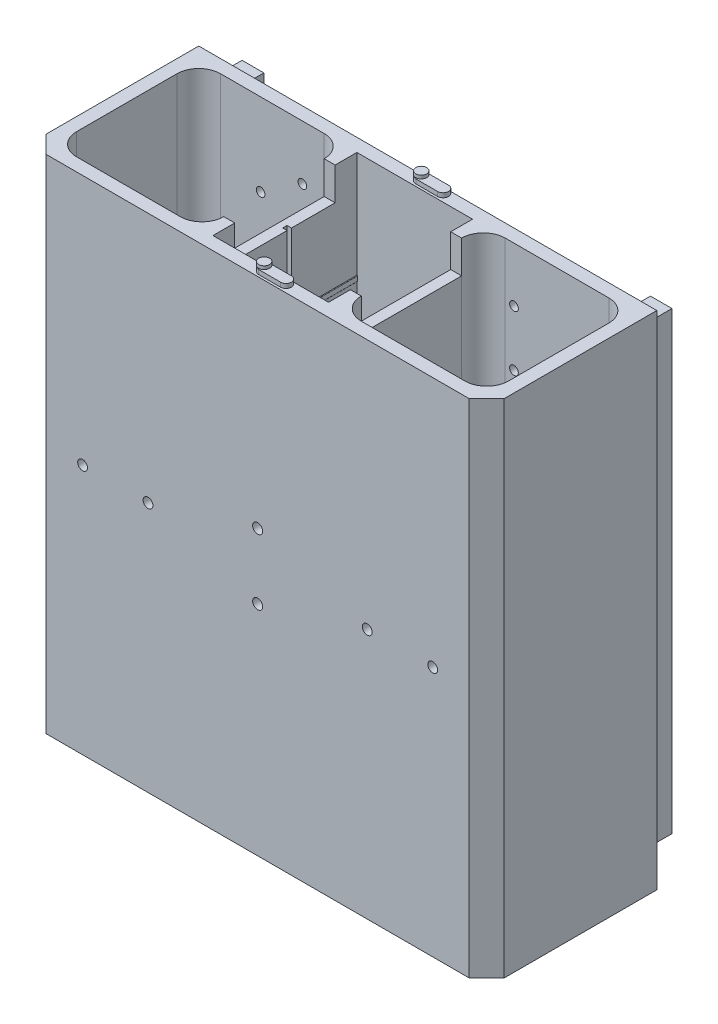
from build123d import *

# Parameters (mm, degrees)
SKETCH_1_W           = 210
SKETCH_1_H           = 230
EXTRUDE_1_DEPTH      = 6
SKETCH_2_W           = 9.85
SKETCH_2_H           = 208.5
SKETCH_2_W_2         = 10
EXTRUDE_3_DEPTH      = 15
SKETCH_3_R           = 2
CUT_EXTRUDE_1_DEPTH  = 10
SKETCH_17_W          = 6
SKETCH_17_H          = 230
EXTRUDE_9_DEPTH      = 66
EXTRUDE_10_DEPTH     = 6
CHAMFER_3_SIZE       = 8
SKETCH_19_W          = 5
SKETCH_19_H          = 230
EXTRUDE_11_DEPTH     = 66
FILLET_4_R           = 10
SKETCH_21_R          = 2.3
CUT_EXTRUDE_9_DEPTH  = 6
EXTRUDE_13_DEPTH     = 66
SKETCH_28_W          = 53
SKETCH_28_H          = 3
EXTRUDE_14_DEPTH     = 66
SKETCH_30_W          = 2
SKETCH_30_H          = 2
CUT_EXTRUDE_10_DEPTH = 35
SKETCH_31_R          = 1.35
SKETCH_31_W          = 14
SKETCH_31_H          = 14
CUT_EXTRUDE_11_DEPTH = 316.06185361
SKETCH_34_R          = 2.25
CUT_EXTRUDE_14_DEPTH = 30
SKETCH_36_R          = 2.25
CUT_EXTRUDE_15_DEPTH = 30
SKETCH_39_W          = 46
SKETCH_39_H          = 15
CUT_EXTRUDE_16_DEPTH = 104
SKETCH_40_R          = 1.5
EXTRUDE_16_DEPTH     = 3
SKETCH_41_R          = 2.5
EXTRUDE_17_DEPTH     = 1.5
SKETCH_44_R          = 1.62
EXTRUDE_19_DEPTH     = 2
SKETCH_46_R          = 1.62
EXTRUDE_20_DEPTH     = 2
SKETCH_49_W          = 12
SKETCH_49_H          = 8.46
CUT_EXTRUDE_17_DEPTH = 10
SKETCH_50_W          = 20
SKETCH_50_H          = 8.46
CUT_EXTRUDE_18_DEPTH = 10


with BuildPart() as part:
    # 草图1 → 凸台-拉伸1 (new body)
    with BuildSketch(Plane.XY):
        with Locations((105, 115)):
            Rectangle(SKETCH_1_W, SKETCH_1_H)
    extrude(amount=EXTRUDE_1_DEPTH)

    # 草图2 → 凸台-拉伸3 (add)
    with BuildSketch(Plane(origin=(0, 0, 0), x_dir=(-1, 0, 0), z_dir=(0, 0, -1))):
        with Locations((-197, 115)):
            Rectangle(SKETCH_2_W, SKETCH_2_H)
        with Locations((-9.85, 115)):
            Rectangle(SKETCH_2_W_2, SKETCH_2_H)
    extrude(amount=EXTRUDE_3_DEPTH)

    # 草图3 → 切除-拉伸1 (cut)
    with BuildSketch(Plane(origin=(0, 0, 0), x_dir=(-1, 0, 0), z_dir=(0, 0, -1))):
        with Locations((-169.6425573, 192.25)):
            Circle(SKETCH_3_R)
        with Locations((-150.5, 205)):
            Circle(SKETCH_3_R)
        with Locations((-150.5, 179.5)):
            Circle(SKETCH_3_R)
        with Locations(Location((-150.5, 50.5, 0), (0, 0, 180))):
            Circle(SKETCH_3_R)
        with Locations(Location((-150.5, 25, 0), (0, 0, 180))):
            Circle(SKETCH_3_R)
        with Locations(Location((-169.6425573, 37.75, 0), (0, 0, 180))):
            Circle(SKETCH_3_R)
        with Locations((-34.3574427, 192.25)):
            Circle(SKETCH_3_R)
        with Locations((-53.5, 205)):
            Circle(SKETCH_3_R)
        with Locations((-53.5, 179.5)):
            Circle(SKETCH_3_R)
        with Locations(Location((-53.5, 50.5, 0), (0, 0, 180))):
            Circle(SKETCH_3_R)
        with Locations(Location((-53.5, 25, 0), (0, 0, 180))):
            Circle(SKETCH_3_R)
        with Locations(Location((-34.3574427, 37.75, 0), (0, 0, 180))):
            Circle(SKETCH_3_R)
    extrude(amount=-CUT_EXTRUDE_1_DEPTH, mode=Mode.SUBTRACT)

    # 草图17 → 凸台-拉伸9 (add)
    with BuildSketch(Plane.XY.offset(6)):
        with Locations((3, 115)):
            Rectangle(SKETCH_17_W, SKETCH_17_H)
        with Locations((207, 115)):
            Rectangle(SKETCH_17_W, SKETCH_17_H)
    extrude(amount=EXTRUDE_9_DEPTH)

    # 草图18 → 凸台-拉伸10 (add)
    with BuildSketch(Plane.XY.offset(72)):
        Polygon((210, 230), (204, 230), (6, 230), (0, 230), (0, 0), (6, 0), (204, 0), (210, 0), align=None)
    extrude(amount=EXTRUDE_10_DEPTH)

    # 倒角3
    chamfer_3_edges = [part.edges().sort_by_distance(p)[0] for p in [
        (210, 115, 78),
        (0, 115, 78),
    ]]
    chamfer(chamfer_3_edges, length=CHAMFER_3_SIZE)

    # 草图19 → 凸台-拉伸11 (add)
    with BuildSketch(Plane(origin=(0, 0, 72), x_dir=(-1, 0, 0), z_dir=(0, 0, -1))):
        with Locations((-134, 115)):
            Rectangle(SKETCH_19_W, SKETCH_19_H)
        with Locations((-76, 115)):
            Rectangle(SKETCH_19_W, SKETCH_19_H)
    extrude(amount=EXTRUDE_11_DEPTH)

    # 圆角4
    fillet_4_edges = [part.edges().sort_by_distance(p)[0] for p in [
        (6, 115, 6),
        (6, 115, 72),
        (204, 115, 6),
        (204, 115, 72),
        (73.5, 115, 6),
        (73.5, 115, 72),
        (136.5, 115, 72),
        (136.5, 115, 6),
    ]]
    fillet(fillet_4_edges, radius=FILLET_4_R)

    # 草图21 → 切除-拉伸9 (cut)
    with BuildSketch(Plane.XY.offset(72)):
        with Locations((105, 130)):
            Circle(SKETCH_21_R)
        with Locations((105, 100)):
            Circle(SKETCH_21_R)
    extrude(amount=CUT_EXTRUDE_9_DEPTH, mode=Mode.SUBTRACT)

    # 草图26 → 凸台-拉伸13 (add)
    with BuildSketch(Plane(origin=(0, 0, 72), x_dir=(-1, 0, 0), z_dir=(0, 0, -1))):
        with BuildLine():
            Line((-131.26, 181), (-131.26, 179))
            ThreePointArc((-131.26, 179), (-131.5, 178.76), (-131.74, 179))
            Line((-131.74, 179), (-131.74, 181))
            ThreePointArc((-131.74, 181), (-131.5, 181.24), (-131.26, 181))
        make_face()
        with BuildLine():
            Line((-131.26, 22.5), (-131.26, 20.5))
            ThreePointArc((-131.26, 20.5), (-131.5, 20.26), (-131.74, 20.5))
            Line((-131.74, 20.5), (-131.74, 22.5))
            ThreePointArc((-131.74, 22.5), (-131.5, 22.74), (-131.26, 22.5))
        make_face()
    extrude_13 = extrude(amount=EXTRUDE_13_DEPTH)

    # 镜向2: 凸台-拉伸13 across plane
    add(extrude_13.mirror(Plane.ZY.offset(-105)))

    # 草图28 → 凸台-拉伸14 (add)
    with BuildSketch(Plane(origin=(0, 0, 72), x_dir=(-1, 0, 0), z_dir=(0, 0, -1))):
        with Locations((-105, 9.96)):
            Rectangle(SKETCH_28_W, SKETCH_28_H)
    extrude(amount=EXTRUDE_14_DEPTH)

    # 草图30 → 切除-拉伸10 (cut)
    with BuildSketch(Plane(origin=(0, 230, 0), x_dir=(1, 0, 0), z_dir=(0, 1, 0))):
        with Locations((77.5, -37)):
            Rectangle(SKETCH_30_W, SKETCH_30_H)
    extrude(amount=-CUT_EXTRUDE_10_DEPTH, mode=Mode.SUBTRACT)

    # 草图31 → 切除-拉伸11 (cut, through all)
    with BuildSketch(Plane.XZ.offset(-8.46)):
        with Locations((92.7, 16.2)):
            Circle(SKETCH_31_R)
        with Locations((117.3, 16.2)):
            Circle(SKETCH_31_R)
        with Locations((105, 16.2)):
            Rectangle(SKETCH_31_W, SKETCH_31_H)
    extrude(amount=-CUT_EXTRUDE_11_DEPTH, mode=Mode.SUBTRACT)

    # 草图34 → 切除-拉伸14 (cut)
    with BuildSketch(Plane(origin=(0, 0, 72), x_dir=(-1, 0, 0), z_dir=(0, 0, -1))):
        with Locations((-185.25, 115)):
            Circle(SKETCH_34_R)
        with Locations((-155.25, 115)):
            Circle(SKETCH_34_R)
    extrude(amount=-CUT_EXTRUDE_14_DEPTH, mode=Mode.SUBTRACT)

    # 草图36 → 切除-拉伸15 (cut)
    with BuildSketch(Plane(origin=(0, 0, 72), x_dir=(-1, 0, 0), z_dir=(0, 0, -1))):
        with Locations((-54.75, 115)):
            Circle(SKETCH_36_R)
        with Locations((-24.75, 115)):
            Circle(SKETCH_36_R)
    extrude(amount=-CUT_EXTRUDE_15_DEPTH, mode=Mode.SUBTRACT)

    # 草图39 → 切除-拉伸16 (cut)
    with BuildSketch(Plane.ZY.offset(-73.5)):
        with Locations((39, 222.5)):
            Rectangle(SKETCH_39_W, SKETCH_39_H)
    extrude(amount=-CUT_EXTRUDE_16_DEPTH, mode=Mode.SUBTRACT)

    # 草图40 → 凸台-拉伸16 (add)
    with BuildSketch(Plane(origin=(0, 230, 0), x_dir=(1, 0, 0), z_dir=(0, 1, 0))):
        with Locations(Location((105, -3, 0), (0, 0, 270))):
            Circle(SKETCH_40_R)
    extrude_16 = extrude(amount=EXTRUDE_16_DEPTH)

    # 草图41 → 凸台-拉伸17 (add)
    with BuildSketch(Plane(origin=(0, 233, 0), x_dir=(1, 0, 0), z_dir=(0, 1, 0))):
        with Locations(Location((105, -3, 0), (0, 0, 270))):
            Circle(SKETCH_41_R)
    extrude_17 = extrude(amount=EXTRUDE_17_DEPTH)

    # 镜向3: 凸台-拉伸16, 凸台-拉伸17 across plane
    add(extrude_16.mirror(Plane.XY.offset(39)))
    add(extrude_17.mirror(Plane.XY.offset(39)))

    # 草图49 → 切除-拉伸17 (cut)
    with BuildSketch(Plane.XY.offset(6)):
        with Locations((84.5, 4.23)):
            Rectangle(SKETCH_49_W, SKETCH_49_H)
    extrude(amount=-CUT_EXTRUDE_17_DEPTH, mode=Mode.SUBTRACT)

    # 草图50 → 切除-拉伸18 (cut)
    with BuildSketch(Plane(origin=(78.5, 0, 0), x_dir=(0, 0, -1), z_dir=(1, 0, 0))):
        with Locations((-40, 4.23)):
            Rectangle(SKETCH_50_W, SKETCH_50_H)
    extrude(amount=-CUT_EXTRUDE_18_DEPTH, mode=Mode.SUBTRACT)


with BuildPart() as body_2:
    # 草图44 → 凸台-拉伸19 (new body)
    with BuildSketch(Plane(origin=(0, 230.5, 0), x_dir=(1, 0, 0), z_dir=(0, 1, 0))):
        with BuildLine():
            Line((105, -0.5), (115, -0.5))
            ThreePointArc((115, -0.5), (117.5, -3), (115, -5.5))
            Line((115, -5.5), (105, -5.5))
            ThreePointArc((105, -5.5), (102.5, -3), (105, -0.5))
        make_face()
        with Locations(Location((105, -3, 0), (0, 0, 270))):
            Circle(SKETCH_44_R, mode=Mode.SUBTRACT)
    extrude(amount=EXTRUDE_19_DEPTH)


with BuildPart() as body_3:
    # 草图46 → 凸台-拉伸20 (new body)
    with BuildSketch(Plane(origin=(0, 230.5, 0), x_dir=(1, 0, 0), z_dir=(0, 1, 0))):
        with BuildLine():
            Line((115, -72.5), (105, -72.5))
            ThreePointArc((105, -72.5), (102.5, -75), (105, -77.5))
            Line((105, -77.5), (115, -77.5))
            ThreePointArc((115, -77.5), (117.5, -75), (115, -72.5))
        make_face()
        with Locations(Location((105, -75, 0), (0, 0, 270))):
            Circle(SKETCH_46_R, mode=Mode.SUBTRACT)
    extrude(amount=EXTRUDE_20_DEPTH)


solid = Compound([part.part, body_2.part, body_3.part])
